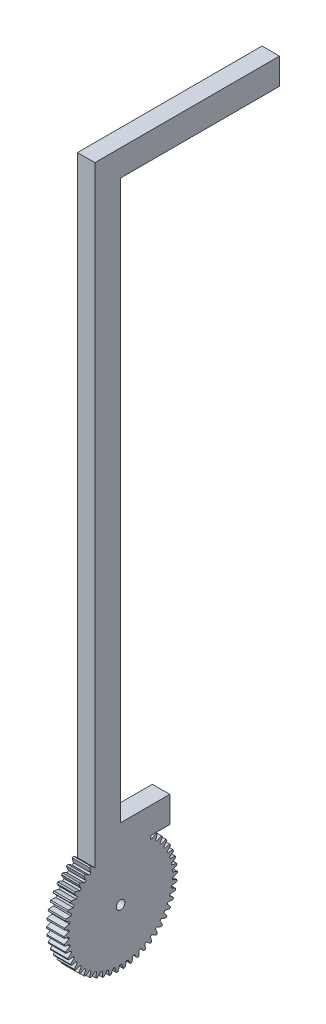
from build123d import *

# Parameters (mm, degrees)
BASPROSKE_W         = 2
BASPROSKE_H         = 6.5
TOOTHCUT_DEPTH      = 10.407443861
TEETHCUTS_COUNT     = 50
TEETHCUTS_ANGLE     = 352.8
BORSKE_R            = 0.5
BORE_DEPTH          = 50.0000508
BOSS_EXTRUDE1_DEPTH = 2


with BuildPart() as part:
    # BasProSke → Base-Revolve (revolve)
    with BuildSketch(Plane(origin=(0, 0, 0), x_dir=(1, 0, 0), z_dir=(0, 1, 0)), mode=Mode.PRIVATE) as base_revolve_sk:
        with Locations((1, 3.25)):
            Rectangle(BASPROSKE_W, BASPROSKE_H)
    revolve(base_revolve_sk.sketch.rotate(Axis((-10, 0, 0), (1, 0, 0)), 180), axis=Axis((-10, 0, 0), (1, 0, 0)))

    # TooCutSke → ToothCut (cut, through all)
    with BuildSketch(Plane(origin=(0, 0, 0), x_dir=(0, 0, -1), z_dir=(1, 0, 0))):
        with BuildLine():
            ThreePointArc((0.106726021, 5.935540566), (0, 5.9365), (-0.106726021, 5.935540566))
            ThreePointArc((-0.106726021, 5.935540566), (-0.20502053, 6.233368102), (-0.339830902, 6.516545106))
            ThreePointArc((-0.339830902, 6.516545106), (0, 6.5254), (0.339830902, 6.516545106))
            ThreePointArc((0.339830902, 6.516545106), (0.20502053, 6.233368102), (0.106726021, 5.935540566))
        make_face()
    toothcut = extrude(amount=TOOTHCUT_DEPTH, mode=Mode.SUBTRACT)

    # TeethCuts: ToothCut ×50 about axis
    teethcuts_axis = Axis((-10, 0, 0), (1, 0, 0))
    for i in range(1, TEETHCUTS_COUNT):
        add(toothcut.rotate(teethcuts_axis, i * TEETHCUTS_ANGLE / (TEETHCUTS_COUNT - 1)), mode=Mode.SUBTRACT)

    # BorSke → Bore (cut, symmetric)
    with BuildSketch(Plane(origin=(0, 0, 0), x_dir=(0, 0, -1), z_dir=(1, 0, 0))):
        with Locations(Location((0, 0, 0), (0, 0, 180))):
            Circle(BORSKE_R)
    extrude(amount=BORE_DEPTH, both=True, mode=Mode.SUBTRACT)

    # Sketch1 → Boss-Extrude1 (add)
    with BuildSketch(Plane(origin=(2, 0, 0), x_dir=(0, 0, -1), z_dir=(1, 0, 0))):
        Polygon((-2.952993201, 5.149938194), (3.25269317, 5.149938194), (5.631250781, 5.149938194), (5.631250781, 8.149938194), (2.706093524, 8.149938194), (0, 8.149938194), (0, 72.149938194), (12.757466939, 72.149938194), (18.208861891, 72.149938194), (18.208861891, 75.149938194), (11.576049668, 75.149938194), (-2.952993201, 75.149938194), align=None)
    extrude(amount=-BOSS_EXTRUDE1_DEPTH)


solid = part.part
